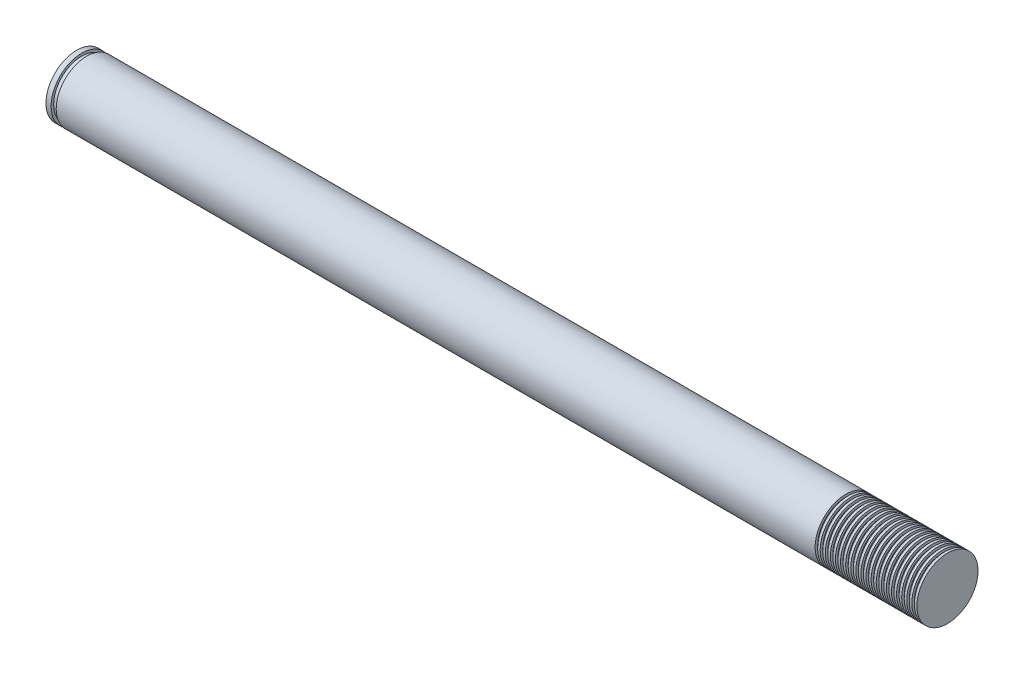
from build123d import *


with BuildPart() as part:
    # Sketch1 → Revolve1 (revolve)
    with BuildSketch(Plane.XY, mode=Mode.PRIVATE) as revolve1_sk:
        Polygon((0, 0), (171, 0), (171, 5.5), (171, 6), (170.5, 6), (170.5, 5.5), (170, 5.5), (170, 6), (169.5, 6), (169.5, 5.5), (169, 5.5), (169, 6), (168.5, 6), (168.5, 5.5), (168, 5.5), (168, 6), (167.5, 6), (167.5, 5.5), (167, 5.5), (167, 6), (166.5, 6), (166.5, 5.5), (166, 5.5), (166, 6), (165.5, 6), (165.5, 5.5), (165, 5.5), (165, 6), (164.5, 6), (164.5, 5.5), (164, 5.5), (164, 6), (163.5, 6), (163.5, 5.5), (163, 5.5), (163, 6), (162.5, 6), (162.5, 5.5), (162, 5.5), (162, 6), (161.5, 6), (161.5, 5.5), (161, 5.5), (161, 6), (160.5, 6), (160.5, 5.5), (160, 5.5), (160, 6), (159.5, 6), (159.5, 5.5), (159, 5.5), (159, 6), (158.5, 6), (158.5, 5.5), (158, 5.5), (158, 6), (157.5, 6), (157.5, 5.5), (157, 5.5), (157, 6), (156.5, 6), (156.5, 5.5), (156, 5.5), (156, 6), (155.5, 6), (155.5, 5.5), (155, 5.5), (155, 6), (154.5, 6), (154.5, 5.5), (154, 5.5), (154, 6), (153.5, 6), (153.5, 5.5), (153, 5.5), (153, 6), (152.5, 6), (152.5, 5.5), (152, 5.5), (152, 6), (151.5, 6), (151.5, 5.5), (151, 5.5), (151, 6), (121, 6), (47, 6), (2, 6), (2, 5.5), (1, 5.5), (1, 6), (0, 6), align=None)
    revolve(revolve1_sk.sketch.rotate(Axis((0, 0, 0), (1, 0, 0)), 90), axis=Axis((0, 0, 0), (1, 0, 0)))


solid = part.part
